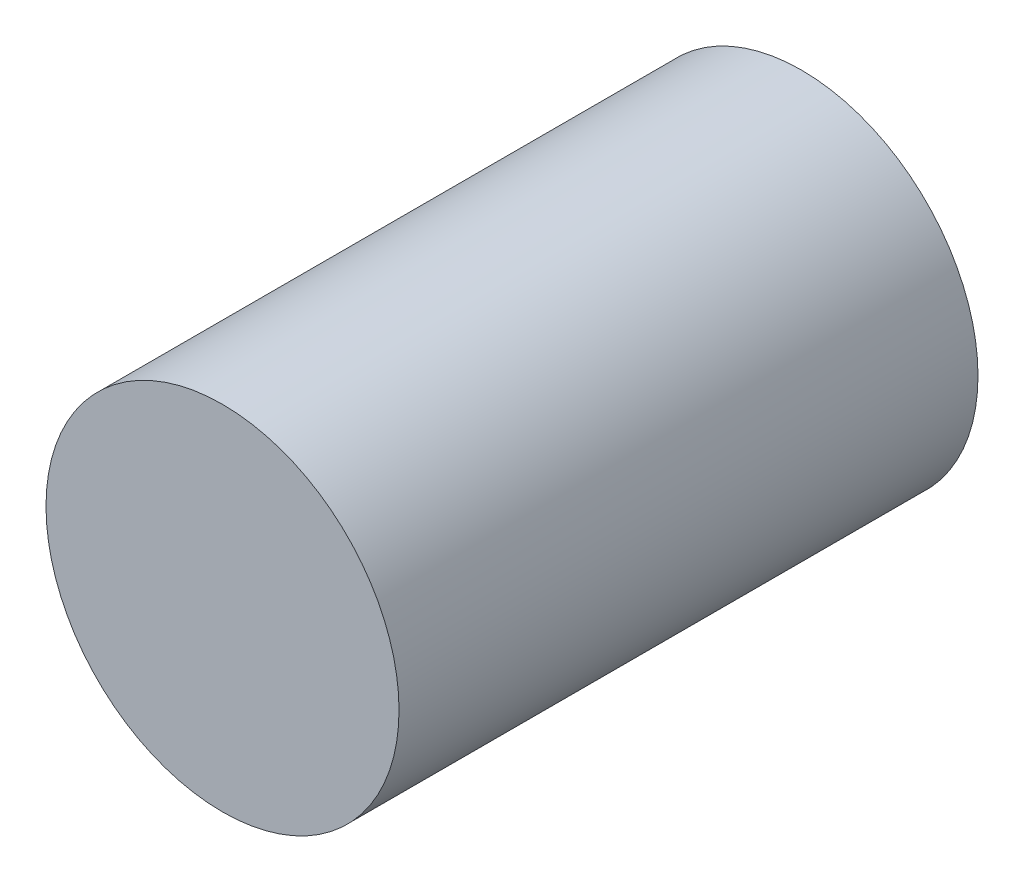
from build123d import *

# Parameters (mm, degrees)
SKETCH1_R           = 25
BOSS_EXTRUDE1_DEPTH = 82


with BuildPart() as part:
    # Sketch1 → Boss-Extrude1 (new body)
    with BuildSketch(Plane.XY):
        Circle(SKETCH1_R)
    extrude(amount=BOSS_EXTRUDE1_DEPTH)


solid = part.part
